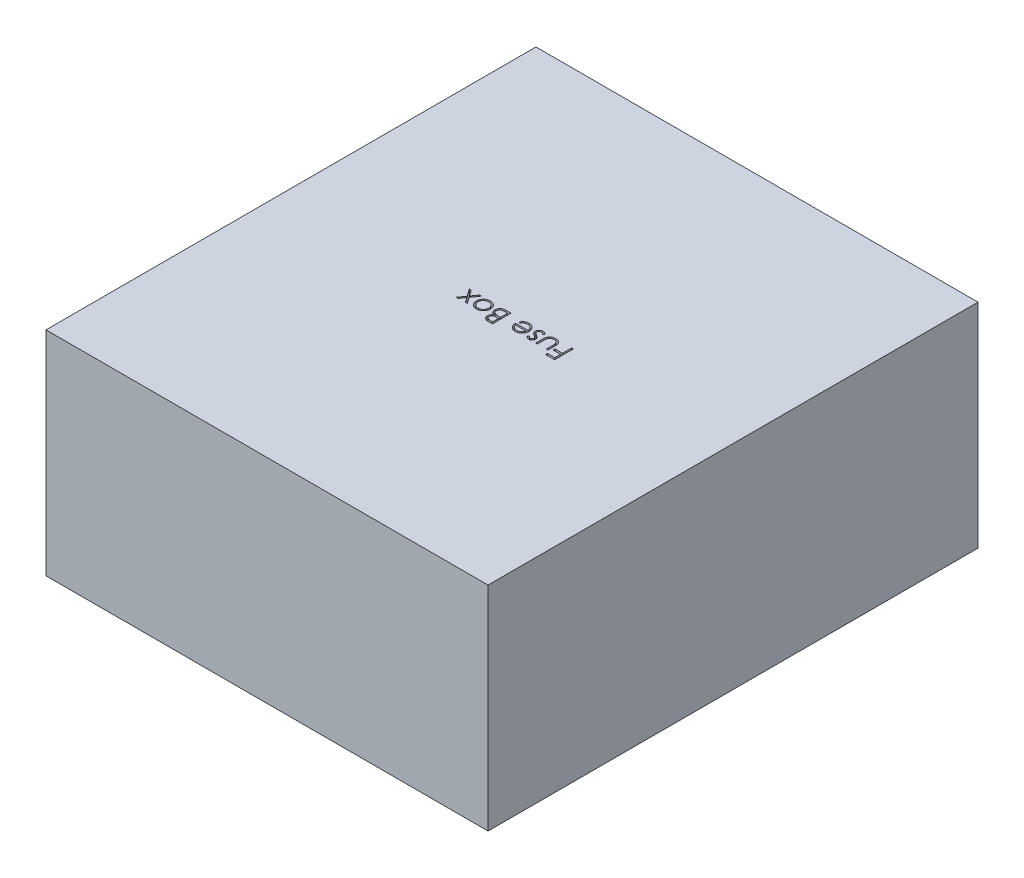
from build123d import *

# Parameters (mm, degrees)
SKETCH1_W           = 83
SKETCH1_H           = 92
BOSS_EXTRUDE1_DEPTH = 40
CUT_EXTRUDE1_DEPTH  = 2


with BuildPart() as part:
    # Sketch1 → Boss-Extrude1 (new body)
    with BuildSketch(Plane(origin=(0, 0, 0), x_dir=(1, 0, 0), z_dir=(0, 1, 0))):
        Rectangle(SKETCH1_W, SKETCH1_H)
    extrude(amount=BOSS_EXTRUDE1_DEPTH)

    # Sketch2 → Cut-Extrude1 (cut)
    # profile 1 of 7: a face of its own
    with BuildSketch(Plane(origin=(0, 40, 0), x_dir=(-1, 0, 0), z_dir=(0, 1, 0))):
        Polygon((-11.110345403, 3.114697888), (-9.405217198, 3.114697888), (-9.405217198, 2.755723529), (-10.796242839, 2.755723529), (-10.796242839, 1.678800452), (-9.405217198, 1.678800452), (-9.405217198, 1.319826093), (-10.796242839, 1.319826093), (-10.796242839, -0.385302112), (-11.110345403, -0.385302112), align=None)
    # profile 2 of 7: a face of its own
    with BuildSketch(Plane(origin=(0, 40, 0), x_dir=(-1, 0, 0), z_dir=(0, 1, 0))):
        with BuildLine():
            Line((-8.911627455, 2.172390196), (-8.59752489, 2.172390196))
            Line((-8.59752489, 2.172390196), (-8.59752489, 0.986092119))
            add(Edge.make_bspline(
                [(-8.59752489, 0.986092119), (-8.597382986, 0.95126937), (-8.597111528, 0.884655082), (-8.595270587, 0.788799895), (-8.590940494, 0.701383182), (-8.585526669, 0.622354446), (-8.578564533, 0.551727054), (-8.570281172, 0.489747697), (-8.561022751, 0.435713513), (-8.551960037, 0.403170157), (-8.547745243, 0.388035228)],
                knots=[0, 0, 0, 0, 1.388932606, 2.656963016, 3.823490214, 4.879454478, 5.816252168, 6.653371382, 7.373723809, 8, 8, 8, 8], degree=3))
            add(Edge.make_bspline(
                [(-8.547745243, 0.388035228), (-8.540983788, 0.369012357), (-8.527601447, 0.331362096), (-8.503327963, 0.276973091), (-8.473299627, 0.226597808), (-8.440439799, 0.178293736), (-8.402540391, 0.133491749), (-8.36008092, 0.092267505), (-8.314482683, 0.053063414), (-8.24672766, 0.006678622), (-8.154068394, -0.043036708), (-8.032415638, -0.085932527), (-7.900511413, -0.111568347), (-7.809346693, -0.114542602), (-7.762488833, -0.116071343)],
                knots=[0, 0, 0, 0, 0.725840625, 1.436591201, 2.137033971, 2.831655856, 3.53531722, 4.242432219, 4.957935707, 5.694543706, 7.190802206, 8.724350549, 10.316345118, 12, 12, 12, 12], degree=3))
            add(Edge.make_bspline(
                [(-7.762488833, -0.116071343), (-7.715635325, -0.114510094), (-7.624982457, -0.111489367), (-7.494527488, -0.086705828), (-7.375276073, -0.045300139), (-7.268425122, 0.012507273), (-7.174459282, 0.083249335), (-7.096154863, 0.166258144), (-7.031547608, 0.258907531), (-7.003338188, 0.32803181), (-6.989151493, 0.362794843)],
                knots=[0, 0, 0, 0, 1.157059328, 2.238695713, 3.266970494, 4.264342957, 5.228770407, 6.160125903, 7.074715775, 8, 8, 8, 8], degree=3))
            add(Edge.make_bspline(
                [(-6.989151493, 0.362794843), (-6.984957263, 0.376761142), (-6.975684845, 0.407637217), (-6.965722493, 0.460016966), (-6.956748032, 0.52248157), (-6.949084855, 0.595439779), (-6.943619693, 0.678700932), (-6.940673666, 0.772239008), (-6.937345391, 0.875760368), (-6.937294875, 0.948228127), (-6.93726848, 0.986092119)],
                knots=[0, 0, 0, 0, 0.557542046, 1.232589297, 2.036731608, 2.971723315, 4.038036528, 5.22795436, 6.551621927, 8, 8, 8, 8], degree=3))
            Line((-6.93726848, 0.986092119), (-6.93726848, 2.172390196))
            Line((-6.93726848, 2.172390196), (-6.623165916, 2.172390196))
            Line((-6.623165916, 2.172390196), (-6.623165916, 0.927197888))
            add(Edge.make_bspline(
                [(-6.623165916, 0.927197888), (-6.623607611, 0.884890717), (-6.624464559, 0.802809017), (-6.629971903, 0.683524905), (-6.639421515, 0.572362661), (-6.6537642, 0.469263441), (-6.670629875, 0.374305959), (-6.692386148, 0.287368513), (-6.718364386, 0.208718959), (-6.747669901, 0.136977182), (-6.782291768, 0.071930288), (-6.819118789, 0.010194471), (-6.861643561, -0.046698464), (-6.906413795, -0.101580601), (-6.956215451, -0.151722128), (-7.01011531, -0.198273604), (-7.06735473, -0.241946636), (-7.129203928, -0.281037915), (-7.19475999, -0.316254561), (-7.264103847, -0.347470639), (-7.338084846, -0.372173216), (-7.415748483, -0.393483882), (-7.497475262, -0.410198351), (-7.583186395, -0.421984918), (-7.672853011, -0.429210249), (-7.733962471, -0.429847293), (-7.76529332, -0.430173907)],
                knots=[0, 0, 0, 0, 1.493040784, 2.896703357, 4.213163133, 5.428574705, 6.569057535, 7.615249723, 8.588095153, 9.490268104, 10.346124644, 11.18633936, 12.024365274, 12.850166724, 13.684164916, 14.514361689, 15.362232829, 16.222528818, 17.093394965, 17.986930858, 18.902426812, 19.842810585, 20.827885679, 21.843828298, 22.894529745, 24, 24, 24, 24], degree=3))
            add(Edge.make_bspline(
                [(-7.76529332, -0.430173907), (-7.796389834, -0.429834199), (-7.857497379, -0.429166643), (-7.947168623, -0.422024836), (-8.03311723, -0.410216665), (-8.115037628, -0.393361448), (-8.193012026, -0.372322378), (-8.267356265, -0.347318842), (-8.337199828, -0.31623836), (-8.403381832, -0.281260803), (-8.465384221, -0.241695528), (-8.523492799, -0.198327488), (-8.577629651, -0.151221425), (-8.627806719, -0.100574068), (-8.673319696, -0.045757131), (-8.714735738, 0.012788429), (-8.752692443, 0.074482518), (-8.787045233, 0.14054568), (-8.816556989, 0.21311769), (-8.842612234, 0.293414787), (-8.863922873, 0.382317304), (-8.881265341, 0.479749232), (-8.895216782, 0.585244274), (-8.904902924, 0.699412689), (-8.910318755, 0.821976381), (-8.911181816, 0.906626271), (-8.911627455, 0.950334907)],
                knots=[0, 0, 0, 0, 1.083640291, 2.129454052, 3.13281866, 4.105697902, 5.042300162, 5.946461698, 6.836384745, 7.703652036, 8.553297018, 9.397182691, 10.228592656, 11.052265423, 11.879314572, 12.708807002, 13.549817954, 14.402308542, 15.300838682, 16.27712199, 17.341985831, 18.484375296, 19.725102775, 21.0496083, 22.476576903, 24, 24, 24, 24], degree=3))
            Line((-8.911627455, 0.950334907), (-8.911627455, 2.172390196))
        make_face()
    # profile 3 of 7: a face of its own
    with BuildSketch(Plane(origin=(0, 40, 0), x_dir=(-1, 0, 0), z_dir=(0, 1, 0))):
        with BuildLine():
            Line((-4.693678737, 1.853379779), (-4.906819762, 1.633928657))
            add(Edge.make_bspline(
                [(-4.906819762, 1.633928657), (-4.925210266, 1.655241804), (-4.960664992, 1.696331041), (-5.016896473, 1.751268107), (-5.072920076, 1.797405046), (-5.12796889, 1.836357305), (-5.183427159, 1.865806452), (-5.238644077, 1.887301314), (-5.293676815, 1.900603119), (-5.330462851, 1.902317558), (-5.348526493, 1.903159427)],
                knots=[0, 0, 0, 0, 1.26578478, 2.440284043, 3.530471711, 4.527705817, 5.468200915, 6.346673037, 7.188140097, 8, 8, 8, 8], degree=3))
            add(Edge.make_bspline(
                [(-5.348526493, 1.903159427), (-5.370665883, 1.902084554), (-5.414233069, 1.899969356), (-5.476658887, 1.878855926), (-5.534609512, 1.846447187), (-5.584766492, 1.800478604), (-5.627254172, 1.747714335), (-5.658267853, 1.68871801), (-5.677233837, 1.625269966), (-5.679638569, 1.581240108), (-5.680858224, 1.558908625)],
                knots=[0, 0, 0, 0, 0.99966794, 1.967205029, 2.953328237, 3.988086729, 5.028030931, 6.008226631, 6.989793394, 8, 8, 8, 8], degree=3))
            add(Edge.make_bspline(
                [(-5.680858224, 1.558908625), (-5.679747412, 1.538696581), (-5.677528918, 1.49832947), (-5.660282239, 1.438781437), (-5.632816167, 1.380724398), (-5.607145973, 1.345161492), (-5.593919121, 1.326837311)],
                knots=[0, 0, 0, 0, 0.960159726, 1.917612774, 2.927026955, 4, 4, 4, 4], degree=3))
            add(Edge.make_bspline(
                [(-5.593919121, 1.326837311), (-5.585955627, 1.317052727), (-5.569006335, 1.296227472), (-5.53719782, 1.267323619), (-5.501175317, 1.235381368), (-5.457855379, 1.203444531), (-5.409104351, 1.169812806), (-5.353865067, 1.135810673), (-5.293890562, 1.098846248), (-5.250953255, 1.075401812), (-5.228634666, 1.063215516)],
                knots=[0, 0, 0, 0, 0.66740084, 1.420478572, 2.27185888, 3.217733974, 4.268547843, 5.408967954, 6.65319498, 8, 8, 8, 8], degree=3))
            add(Edge.make_bspline(
                [(-5.228634666, 1.063215516), (-5.201421089, 1.047970614), (-5.148853419, 1.018522481), (-5.074160652, 0.972812778), (-5.006373611, 0.927381353), (-4.944917943, 0.88271408), (-4.890976134, 0.837561212), (-4.842911582, 0.793653455), (-4.801923138, 0.749664147), (-4.778969211, 0.718931033), (-4.767997647, 0.704241157)],
                knots=[0, 0, 0, 0, 1.27191281, 2.456916733, 3.569705269, 4.599008579, 5.553216877, 6.436649441, 7.252746552, 8, 8, 8, 8], degree=3))
            add(Edge.make_bspline(
                [(-4.767997647, 0.704241157), (-4.749787119, 0.674575069), (-4.71354479, 0.615534048), (-4.675486524, 0.518315621), (-4.653426249, 0.415205118), (-4.650364029, 0.344672898), (-4.648806942, 0.308808465)],
                knots=[0, 0, 0, 0, 0.995354457, 1.980940102, 2.973342416, 4, 4, 4, 4], degree=3))
            add(Edge.make_bspline(
                [(-4.648806942, 0.308808465), (-4.649526476, 0.283539319), (-4.650944396, 0.233743706), (-4.660802463, 0.160408876), (-4.677757439, 0.090274319), (-4.700851193, 0.022579034), (-4.732035566, -0.041379906), (-4.768583363, -0.103216155), (-4.812458275, -0.161592086), (-4.86254965, -0.216431046), (-4.917395144, -0.266516793), (-4.975901283, -0.310540747), (-5.038140113, -0.347115084), (-5.103666915, -0.377380429), (-5.172630569, -0.401448687), (-5.245041858, -0.418111219), (-5.320670612, -0.42808398), (-5.372100421, -0.429468456), (-5.39830614, -0.430173907)],
                knots=[0, 0, 0, 0, 1.032770009, 2.035186124, 3.017557409, 3.978232242, 4.952395191, 5.920591857, 6.910227898, 7.931268572, 8.952309245, 9.941945286, 10.918353717, 11.897095711, 12.887975737, 13.898235213, 14.929059601, 16, 16, 16, 16], degree=3))
            add(Edge.make_bspline(
                [(-5.39830614, -0.430173907), (-5.433673316, -0.429181206), (-5.503916243, -0.427209599), (-5.607805962, -0.408703538), (-5.709326721, -0.379908144), (-5.807710261, -0.34019221), (-5.900756375, -0.290041497), (-5.985887299, -0.229979103), (-6.063398762, -0.161989106), (-6.107517036, -0.109876195), (-6.129576173, -0.08381974)],
                knots=[0, 0, 0, 0, 1.013940152, 2.01379169, 3.017749504, 4.037548394, 5.051665909, 6.043208538, 7.021604269, 8, 8, 8, 8], degree=3))
            Line((-6.129576173, -0.08381974), (-5.921342999, 0.153159427))
            add(Edge.make_bspline(
                [(-5.921342999, 0.153159427), (-5.901570586, 0.131804662), (-5.863238774, 0.090405222), (-5.801937557, 0.035280882), (-5.739558156, -0.01092039), (-5.67672347, -0.049563804), (-5.612503375, -0.079339208), (-5.547257761, -0.100257801), (-5.481119337, -0.113701994), (-5.436697201, -0.115280276), (-5.414431942, -0.116071343)],
                knots=[0, 0, 0, 0, 1.179806542, 2.287233372, 3.337373186, 4.324005949, 5.273901747, 6.200048787, 7.097828587, 8, 8, 8, 8], degree=3))
            add(Edge.make_bspline(
                [(-5.414431942, -0.116071343), (-5.384114016, -0.114700518), (-5.324877874, -0.112022156), (-5.240034116, -0.087705064), (-5.161695489, -0.049575112), (-5.093672144, 0.004509586), (-5.035769983, 0.067465159), (-4.993841808, 0.138379278), (-4.967565633, 0.215170735), (-4.964479634, 0.268403037), (-4.962909506, 0.295487151)],
                knots=[0, 0, 0, 0, 1.072336372, 2.095165389, 3.102688358, 4.141489647, 5.156069229, 6.117746104, 7.042326257, 8, 8, 8, 8], degree=3))
            add(Edge.make_bspline(
                [(-4.962909506, 0.295487151), (-4.9639958, 0.31779677), (-4.966140543, 0.361844125), (-4.982983815, 0.425594466), (-5.009596667, 0.486063747), (-5.035801316, 0.521453394), (-5.049147487, 0.539477536)],
                knots=[0, 0, 0, 0, 1.013901739, 2.00181326, 2.98231254, 4, 4, 4, 4], degree=3))
            add(Edge.make_bspline(
                [(-5.049147487, 0.539477536), (-5.057169881, 0.548512898), (-5.074645554, 0.56819518), (-5.106700795, 0.596620259), (-5.145082657, 0.627258358), (-5.19022282, 0.659589947), (-5.242212282, 0.693188552), (-5.301261757, 0.727877904), (-5.36656231, 0.76530563), (-5.412732941, 0.790125285), (-5.436867839, 0.803099331)],
                knots=[0, 0, 0, 0, 0.615000592, 1.339693406, 2.178160186, 3.116406724, 4.166410947, 5.330106347, 6.604359322, 8, 8, 8, 8], degree=3))
            add(Edge.make_bspline(
                [(-5.436867839, 0.803099331), (-5.462914479, 0.817638462), (-5.513427227, 0.845834479), (-5.584974518, 0.889750559), (-5.649521872, 0.934417833), (-5.708622446, 0.977330673), (-5.760783452, 1.020751617), (-5.8057994, 1.064728868), (-5.845442616, 1.107488854), (-5.867390028, 1.137786151), (-5.877873448, 1.152257984)],
                knots=[0, 0, 0, 0, 1.262093308, 2.447601706, 3.550203992, 4.582594899, 5.537233252, 6.418365656, 7.244515135, 8, 8, 8, 8], degree=3))
            add(Edge.make_bspline(
                [(-5.877873448, 1.152257984), (-5.896004048, 1.181403599), (-5.932271583, 1.239705015), (-5.967486774, 1.337015491), (-5.991692803, 1.439460549), (-5.993855193, 1.510147403), (-5.994960788, 1.546288433)],
                knots=[0, 0, 0, 0, 0.985009483, 1.970363186, 2.962279964, 4, 4, 4, 4], degree=3))
            add(Edge.make_bspline(
                [(-5.994960788, 1.546288433), (-5.994426593, 1.569913831), (-5.993381097, 1.616152082), (-5.985037045, 1.684090902), (-5.969845334, 1.748639056), (-5.950790411, 1.810765919), (-5.924307407, 1.869268013), (-5.892661502, 1.924925484), (-5.855474077, 1.977661402), (-5.812630786, 2.026664534), (-5.765524141, 2.071173861), (-5.714629371, 2.109972489), (-5.661091114, 2.143078843), (-5.604682695, 2.170844004), (-5.544862222, 2.191845387), (-5.482047836, 2.206302772), (-5.416366681, 2.215957975), (-5.371465555, 2.216821059), (-5.348526493, 2.217261991)],
                knots=[0, 0, 0, 0, 1.087655834, 2.128696564, 3.144119009, 4.137814668, 5.115653402, 6.093965665, 7.082169637, 8.081268856, 9.086088321, 10.061021666, 11.022561449, 11.980240094, 12.950172527, 13.934149372, 14.944599409, 16, 16, 16, 16], degree=3))
            add(Edge.make_bspline(
                [(-5.348526493, 2.217261991), (-5.32133443, 2.21615765), (-5.266440208, 2.213928252), (-5.184085582, 2.196222562), (-5.10185224, 2.167089458), (-5.01952889, 2.126853224), (-4.9377186, 2.074786349), (-4.855701744, 2.011857049), (-4.772493713, 1.938479335), (-4.7205374, 1.882380109), (-4.693678737, 1.853379779)],
                knots=[0, 0, 0, 0, 0.845714091, 1.707292901, 2.609013841, 3.555613372, 4.552488639, 5.621697636, 6.770543573, 8, 8, 8, 8], degree=3))
        make_face()
    # profile 4 of 7: a face of its own
    with BuildSketch(Plane(origin=(0, 40, 0), x_dir=(-1, 0, 0), z_dir=(0, 1, 0))):
        with BuildLine():
            Line((-1.92144316, 0.422390196), (-1.642396685, 0.275855741))
            add(Edge.make_bspline(
                [(-1.642396685, 0.275855741), (-1.664633281, 0.23641241), (-1.707896889, 0.159671307), (-1.782297637, 0.054239446), (-1.86028971, -0.04060827), (-1.945393678, -0.122337924), (-2.035063357, -0.193589309), (-2.129796011, -0.255927134), (-2.230084829, -0.309045654), (-2.335934554, -0.353798182), (-2.448234105, -0.388207676), (-2.567255621, -0.412511897), (-2.693227117, -0.427535165), (-2.779573297, -0.429280306), (-2.82378691, -0.430173907)],
                knots=[0, 0, 0, 0, 1.120438281, 2.179929193, 3.190490725, 4.156257408, 5.095198341, 6.022838206, 6.959905092, 7.901321166, 8.864066838, 9.862729781, 10.905609505, 12, 12, 12, 12], degree=3))
            add(Edge.make_bspline(
                [(-2.82378691, -0.430173907), (-2.872928887, -0.429026731), (-2.968790649, -0.426788925), (-3.108330396, -0.40749646), (-3.239709814, -0.376024101), (-3.362921518, -0.33205856), (-3.47766377, -0.274631236), (-3.584164625, -0.204671754), (-3.682984151, -0.122539499), (-3.77100836, -0.027523056), (-3.850252243, 0.074158901), (-3.920178063, 0.180114786), (-3.978635494, 0.29007801), (-4.026188104, 0.403348534), (-4.064592969, 0.519212428), (-4.091359673, 0.638723896), (-4.106789421, 0.76155948), (-4.109153866, 0.844656816), (-4.110345403, 0.886532824)],
                knots=[0, 0, 0, 0, 1.145258523, 2.234067595, 3.276747158, 4.290159414, 5.277019952, 6.260822364, 7.254936242, 8.264827045, 9.274100331, 10.257902744, 11.220704747, 12.172965371, 13.118907548, 14.062713208, 15.023725156, 16, 16, 16, 16], degree=3))
            add(Edge.make_bspline(
                [(-4.110345403, 0.886532824), (-4.109286262, 0.925827655), (-4.107187184, 1.003704819), (-4.093956396, 1.118970364), (-4.070508103, 1.230998816), (-4.038331779, 1.339883264), (-3.996780533, 1.445441398), (-3.945948314, 1.547737462), (-3.885755936, 1.646662602), (-3.839283262, 1.709065735), (-3.815874249, 1.74049917)],
                knots=[0, 0, 0, 0, 1.024358464, 2.0301432, 3.019427413, 4.004406732, 4.986367066, 5.972626655, 6.978780325, 8, 8, 8, 8], degree=3))
            add(Edge.make_bspline(
                [(-3.815874249, 1.74049917), (-3.784166567, 1.77836804), (-3.72175562, 1.852906191), (-3.616199265, 1.950844517), (-3.501899068, 2.032888292), (-3.380287442, 2.100895428), (-3.249950968, 2.152569075), (-3.112641677, 2.191076657), (-2.966796091, 2.212654668), (-2.86709087, 2.215702502), (-2.81607457, 2.217261991)],
                knots=[0, 0, 0, 0, 1.030682036, 2.02871468, 2.997146059, 3.962720338, 4.930598197, 5.918074684, 6.934738563, 8, 8, 8, 8], degree=3))
            add(Edge.make_bspline(
                [(-2.81607457, 2.217261991), (-2.763626965, 2.215907942), (-2.660736719, 2.213251607), (-2.510704598, 2.188625273), (-2.368743881, 2.149572719), (-2.234911377, 2.094418928), (-2.109193516, 2.023259376), (-1.992407467, 1.935117535), (-1.882555954, 1.832699448), (-1.818647375, 1.753936238), (-1.786126653, 1.713856542)],
                knots=[0, 0, 0, 0, 1.056321875, 2.072262726, 3.055038591, 4.01806755, 4.982017516, 5.957941055, 6.960871419, 8, 8, 8, 8], degree=3))
            add(Edge.make_bspline(
                [(-1.786126653, 1.713856542), (-1.763999715, 1.683652961), (-1.719893122, 1.623446842), (-1.664646022, 1.525275685), (-1.616688627, 1.422565091), (-1.578355666, 1.313654793), (-1.547316165, 1.199835213), (-1.524859346, 1.080292669), (-1.511689727, 0.955062757), (-1.50910103, 0.869736202), (-1.507781301, 0.82623635)],
                knots=[0, 0, 0, 0, 0.94817472, 1.890038105, 2.849395472, 3.817997239, 4.812318967, 5.836947057, 6.897266129, 8, 8, 8, 8], degree=3))
            Line((-1.507781301, 0.82623635), (-3.796242839, 0.82623635))
            add(Edge.make_bspline(
                [(-3.796242839, 0.82623635), (-3.794703233, 0.792535886), (-3.791675659, 0.726265282), (-3.777560516, 0.629294499), (-3.755311742, 0.536921157), (-3.724042679, 0.449838115), (-3.686175834, 0.366907987), (-3.639790117, 0.28874595), (-3.584450563, 0.21570802), (-3.522724864, 0.147140882), (-3.454017769, 0.086080121), (-3.381735021, 0.031428345), (-3.304841456, -0.014377252), (-3.223943373, -0.051557141), (-3.139171588, -0.080663457), (-3.050499393, -0.100531278), (-2.958101276, -0.113838385), (-2.895115542, -0.11531805), (-2.86304973, -0.116071343)],
                knots=[0, 0, 0, 0, 1.094153842, 2.151609401, 3.174256925, 4.172055639, 5.149267565, 6.128595816, 7.11444997, 8.118368179, 9.117203808, 10.09244225, 11.054858984, 12.015122123, 12.976791628, 13.957293641, 14.960065497, 16, 16, 16, 16], degree=3))
            add(Edge.make_bspline(
                [(-2.86304973, -0.116071343), (-2.831698583, -0.115463286), (-2.769491892, -0.114256785), (-2.676851034, -0.102524874), (-2.585711507, -0.083554598), (-2.496450524, -0.057664608), (-2.410879678, -0.026087756), (-2.331634128, 0.012015102), (-2.258753912, 0.054164848), (-2.190636946, 0.102374523), (-2.124565952, 0.16138271), (-2.059023466, 0.235018431), (-1.988746812, 0.322105959), (-1.94475722, 0.387651625), (-1.92144316, 0.422390196)],
                knots=[0, 0, 0, 0, 0.99110716, 1.966546729, 2.947904876, 3.932708344, 4.903319531, 5.828989031, 6.710028674, 7.56322171, 8.463672341, 9.504779593, 10.677557249, 12, 12, 12, 12], degree=3))
        make_face()
        with BuildLine():
            add(Edge.make_bspline(
                [(-1.821883865, 1.140338914), (-1.833380489, 1.182001788), (-1.855507791, 1.262189408), (-1.901744155, 1.373230299), (-1.953815696, 1.4719182), (-2.015437427, 1.557497833), (-2.085256153, 1.633501346), (-2.165901336, 1.699919931), (-2.256337229, 1.759337382), (-2.35609637, 1.809489881), (-2.461738155, 1.85217974), (-2.572344347, 1.880804856), (-2.685202135, 1.900414398), (-2.761536421, 1.902240507), (-2.799948769, 1.903159427)],
                knots=[0, 0, 0, 0, 1.154881502, 2.222775134, 3.210006277, 4.132804581, 5.035138423, 5.962687519, 6.919655026, 7.923214229, 8.944639381, 9.960483929, 10.97369054, 12, 12, 12, 12], degree=3))
            add(Edge.make_bspline(
                [(-2.799948769, 1.903159427), (-2.831298207, 1.902547755), (-2.893269456, 1.901338609), (-2.984570524, 1.88986848), (-3.072250223, 1.870908635), (-3.156955511, 1.844943678), (-3.237576379, 1.810335076), (-3.315771148, 1.769751849), (-3.389551544, 1.720210265), (-3.435692839, 1.682451411), (-3.459003256, 1.663375773)],
                knots=[0, 0, 0, 0, 1.04873581, 2.073130211, 3.073294108, 4.04793562, 5.032784715, 6.005352987, 6.992311501, 8, 8, 8, 8], degree=3))
            add(Edge.make_bspline(
                [(-3.459003256, 1.663375773), (-3.475696538, 1.648281457), (-3.509479672, 1.617734241), (-3.554620194, 1.565105035), (-3.597840666, 1.508353472), (-3.637174319, 1.445308348), (-3.673251905, 1.376687569), (-3.707011883, 1.303069934), (-3.737398295, 1.223896803), (-3.754494405, 1.168724364), (-3.763290115, 1.140338914)],
                knots=[0, 0, 0, 0, 0.879870761, 1.780643979, 2.707998968, 3.669668524, 4.684282772, 5.740141944, 6.837334558, 8, 8, 8, 8], degree=3))
            Line((-3.763290115, 1.140338914), (-1.821883865, 1.140338914))
        make_face(mode=Mode.SUBTRACT)
    # profile 5 of 7: a face of its own
    with BuildSketch(Plane(origin=(0, 40, 0), x_dir=(-1, 0, 0), z_dir=(0, 1, 0))):
        with BuildLine():
            Line((0.556321263, 3.114697888), (1.239213892, 3.114697888))
            add(Edge.make_bspline(
                [(1.239213892, 3.114697888), (1.27264237, 3.114522138), (1.33743508, 3.11418149), (1.431654522, 3.108898359), (1.519903333, 3.101694689), (1.602207105, 3.090264596), (1.678527807, 3.076472819), (1.749095445, 3.059771003), (1.813685617, 3.039744389), (1.890798353, 3.007898108), (1.978719014, 2.96057494), (2.073917407, 2.890646375), (2.155321646, 2.805113911), (2.225507963, 2.708631256), (2.281309083, 2.602495484), (2.32167838, 2.489236295), (2.347236256, 2.370314554), (2.34986469, 2.288671376), (2.351193058, 2.247410228)],
                knots=[0, 0, 0, 0, 1.001505555, 1.941167018, 2.826882275, 3.653841531, 4.429895133, 5.150066043, 5.825578002, 6.45369114, 7.647487171, 8.808567382, 9.977351308, 11.170798116, 12.373658725, 13.556498008, 14.765093433, 16, 16, 16, 16], degree=3))
            add(Edge.make_bspline(
                [(2.351193058, 2.247410228), (2.35009984, 2.208757672), (2.347951562, 2.132801755), (2.327408803, 2.021707646), (2.295248135, 1.915956427), (2.250542886, 1.815934042), (2.192440889, 1.723900429), (2.123582571, 1.639113163), (2.040505768, 1.565162106), (1.978262528, 1.523819203), (1.946645783, 1.502818882)],
                knots=[0, 0, 0, 0, 1.044552857, 2.05264487, 3.044412934, 4.028983338, 5.005914585, 5.980388656, 6.974128949, 8, 8, 8, 8], degree=3))
            add(Edge.make_bspline(
                [(1.946645783, 1.502818882), (1.98640621, 1.487553883), (2.062477758, 1.458348159), (2.16716377, 1.406712695), (2.257358615, 1.350550584), (2.333755761, 1.289218734), (2.399093416, 1.223109923), (2.456146357, 1.151254809), (2.504827732, 1.072716051), (2.546540655, 0.988312516), (2.579089411, 0.898906047), (2.603465316, 0.805335271), (2.617432765, 0.707935716), (2.619420406, 0.641650337), (2.620423827, 0.608187472)],
                knots=[0, 0, 0, 0, 1.27268992, 2.434971085, 3.483601985, 4.442670788, 5.356604649, 6.2567628, 7.179492994, 8.113709626, 9.066344395, 10.018646069, 10.999752585, 12, 12, 12, 12], degree=3))
            add(Edge.make_bspline(
                [(2.620423827, 0.608187472), (2.619446981, 0.574020599), (2.61752501, 0.506796321), (2.603345038, 0.408041187), (2.579335931, 0.31366624), (2.546264784, 0.223061058), (2.50310247, 0.136400923), (2.450574505, 0.053587659), (2.387942942, -0.024546672), (2.317880073, -0.098870295), (2.238617927, -0.165698082), (2.153102172, -0.225213789), (2.060255853, -0.274159851), (1.961603859, -0.315275872), (1.856039542, -0.346683071), (1.744036935, -0.368655645), (1.625692633, -0.383460682), (1.544482882, -0.384677887), (1.502835686, -0.385302112)],
                knots=[0, 0, 0, 0, 0.978564426, 1.925352924, 2.850884081, 3.763762016, 4.682927383, 5.618979971, 6.567305752, 7.547517671, 8.540179244, 9.531824382, 10.526200242, 11.540722885, 12.589160233, 13.674978461, 14.80764778, 16, 16, 16, 16], degree=3))
            Line((1.502835686, -0.385302112), (0.556321263, -0.385302112))
            Line((0.556321263, -0.385302112), (0.556321263, 3.114697888))
        make_face()
        with BuildLine():
            Line((0.870423827, 2.755723529), (0.870423827, 1.633928657))
            Line((0.870423827, 1.633928657), (1.081461488, 1.633928657))
            add(Edge.make_bspline(
                [(1.081461488, 1.633928657), (1.112310283, 1.634328581), (1.171916442, 1.635101313), (1.258236339, 1.63731483), (1.338361357, 1.643512874), (1.41215319, 1.649709136), (1.479495634, 1.659783723), (1.540239496, 1.671775846), (1.595338093, 1.684458751), (1.658877638, 1.706028238), (1.730950587, 1.737905914), (1.807783691, 1.78737775), (1.87551816, 1.846302103), (1.932715348, 1.914293065), (1.979526819, 1.98915925), (2.012040534, 2.069706131), (2.034087818, 2.153926263), (2.036079349, 2.211744516), (2.037090494, 2.241100132)],
                knots=[0, 0, 0, 0, 1.156816544, 2.235205308, 3.236616184, 4.169592532, 5.011045266, 5.787822928, 6.49130361, 7.128639758, 8.301311294, 9.436451833, 10.541879658, 11.654887649, 12.756523258, 13.837046038, 14.901820046, 16, 16, 16, 16], degree=3))
            add(Edge.make_bspline(
                [(2.037090494, 2.241100132), (2.036564314, 2.260525903), (2.035532154, 2.298631675), (2.027078851, 2.35418103), (2.012711277, 2.406424782), (1.994256984, 2.456078892), (1.968468295, 2.501590743), (1.938104832, 2.544533938), (1.901419141, 2.583446057), (1.859661829, 2.619815555), (1.811653206, 2.652060083), (1.757421914, 2.680300846), (1.696234237, 2.703041623), (1.629121382, 2.722957775), (1.555050295, 2.736946069), (1.474875741, 2.748599457), (1.387941022, 2.754532199), (1.32779592, 2.755317562), (1.296705879, 2.755723529)],
                knots=[0, 0, 0, 0, 0.91205012, 1.789085906, 2.630437955, 3.453916878, 4.269457761, 5.079663411, 5.91843418, 6.774407191, 7.675494373, 8.627863946, 9.638891023, 10.736472738, 11.911756761, 13.175263542, 14.539845004, 16, 16, 16, 16], degree=3))
            Line((1.296705879, 2.755723529), (0.870423827, 2.755723529))
        make_face(mode=Mode.SUBTRACT)
        with BuildLine():
            Line((0.870423827, 1.274954299), (0.870423827, -0.026327753))
            Line((0.870423827, -0.026327753), (1.317739533, -0.026327753))
            add(Edge.make_bspline(
                [(1.317739533, -0.026327753), (1.349758458, -0.025944005), (1.411470717, -0.025204383), (1.500571947, -0.022789828), (1.583155051, -0.017297553), (1.658843187, -0.008651703), (1.728453639, 0.000726746), (1.791151342, 0.013338027), (1.847444536, 0.027786988), (1.912718844, 0.05012116), (1.986222352, 0.084817631), (2.065433208, 0.137131857), (2.135859426, 0.199455165), (2.195664686, 0.271586079), (2.244677674, 0.350017406), (2.280333129, 0.433162756), (2.302323986, 0.519648284), (2.304986155, 0.578614996), (2.306321263, 0.608187472)],
                knots=[0, 0, 0, 0, 1.160039823, 2.235823828, 3.228722157, 4.157150951, 4.99529583, 5.772374946, 6.472645482, 7.099169577, 8.269452708, 9.405989375, 10.527446681, 11.663510218, 12.788923519, 13.866172445, 14.929861265, 16, 16, 16, 16], degree=3))
            add(Edge.make_bspline(
                [(2.306321263, 0.608187472), (2.306045159, 0.626680812), (2.305497404, 0.663369194), (2.297236789, 0.717285013), (2.285222919, 0.769510886), (2.269691485, 0.820188627), (2.247072018, 0.868402003), (2.220665473, 0.915104563), (2.189704072, 0.960358042), (2.141459906, 1.017570296), (2.071287921, 1.083487309), (1.971581146, 1.148024811), (1.858208848, 1.200072618), (1.775981355, 1.222172094), (1.733504757, 1.233588113)],
                knots=[0, 0, 0, 0, 0.723448775, 1.435228256, 2.130040452, 2.821711965, 3.505591119, 4.210454504, 4.921174351, 5.648778258, 7.137944449, 8.670945889, 10.280296675, 12, 12, 12, 12], degree=3))
            add(Edge.make_bspline(
                [(1.733504757, 1.233588113), (1.716475661, 1.237043197), (1.679553069, 1.244534531), (1.619345488, 1.252442235), (1.550609619, 1.259487295), (1.473186742, 1.264698452), (1.386978901, 1.270084996), (1.291801982, 1.272179817), (1.188044668, 1.274679077), (1.116052295, 1.274860211), (1.078657001, 1.274954299)],
                knots=[0, 0, 0, 0, 0.634451884, 1.375622551, 2.216452059, 3.157844607, 4.20941857, 5.370758133, 6.634282058, 8, 8, 8, 8], degree=3))
            Line((1.078657001, 1.274954299), (0.870423827, 1.274954299))
        make_face(mode=Mode.SUBTRACT)
    # profile 6 of 7: a face of its own
    with BuildSketch(Plane(origin=(0, 40, 0), x_dir=(-1, 0, 0), z_dir=(0, 1, 0))):
        with BuildLine():
            add(Edge.make_bspline(
                [(4.484005558, 2.217261991), (4.531996831, 2.2162401), (4.626095989, 2.214236421), (4.763903875, 2.192821455), (4.89544901, 2.160074091), (5.021235203, 2.114802529), (5.139651498, 2.054120578), (5.252422742, 1.981711287), (5.359239751, 1.895928694), (5.42326278, 1.829570625), (5.455760366, 1.795887792)],
                knots=[0, 0, 0, 0, 1.054011418, 2.066658804, 3.057071809, 4.030435133, 4.997543892, 5.974964718, 6.972108034, 8, 8, 8, 8], degree=3))
            add(Edge.make_bspline(
                [(5.455760366, 1.795887792), (5.48374232, 1.763673806), (5.5391647, 1.699869264), (5.610230419, 1.596413651), (5.671451979, 1.489273551), (5.72051494, 1.377026224), (5.759199964, 1.260651553), (5.78666566, 1.139749542), (5.803002595, 1.014587194), (5.805205562, 0.929583356), (5.806321263, 0.886532824)],
                knots=[0, 0, 0, 0, 1.025258237, 2.030674902, 3.01204498, 3.988269485, 4.97094183, 5.956517959, 6.965070386, 8, 8, 8, 8], degree=3))
            add(Edge.make_bspline(
                [(5.806321263, 0.886532824), (5.805339926, 0.843232766), (5.803400758, 0.757669833), (5.785057141, 0.631650467), (5.756526055, 0.509455645), (5.715694217, 0.391596951), (5.663336108, 0.277714124), (5.59944542, 0.168304574), (5.523573803, 0.063152441), (5.437569807, -0.036849397), (5.34251793, -0.129015612), (5.239401782, -0.209343882), (5.130247748, -0.278165406), (5.013604395, -0.333601822), (4.890536908, -0.377311522), (4.76077984, -0.408011538), (4.62453477, -0.426573222), (4.531507548, -0.428956795), (4.484005558, -0.430173907)],
                knots=[0, 0, 0, 0, 0.998656419, 1.973391657, 2.932242238, 3.890759089, 4.846373663, 5.82037756, 6.809684879, 7.83454468, 8.860553229, 9.859544525, 10.845671541, 11.83227036, 12.833544569, 13.85385346, 14.904124723, 16, 16, 16, 16], degree=3))
            add(Edge.make_bspline(
                [(4.484005558, -0.430173907), (4.436270839, -0.42895271), (4.342779979, -0.426560936), (4.206053997, -0.408083653), (4.076064378, -0.377325671), (3.95283578, -0.333458178), (3.835690933, -0.278163634), (3.725904436, -0.209551945), (3.62270452, -0.128991789), (3.527632536, -0.036855852), (3.44163393, 0.063154104), (3.365760922, 0.168304143), (3.301870596, 0.277714236), (3.249512392, 0.391596921), (3.208680579, 0.509455653), (3.180149486, 0.631650465), (3.161805872, 0.757669834), (3.159866703, 0.843232767), (3.158885366, 0.886532824)],
                knots=[0, 0, 0, 0, 1.099876186, 2.154163076, 3.173186993, 4.173200201, 5.163417411, 6.152872554, 7.150605724, 8.17532212, 9.198891216, 10.186952605, 11.159729845, 12.11414092, 13.071450619, 14.029093627, 15.002601286, 16, 16, 16, 16], degree=3))
            add(Edge.make_bspline(
                [(3.158885366, 0.886532824), (3.160008676, 0.92934937), (3.162232638, 1.014118772), (3.178553147, 1.139045833), (3.205911703, 1.259743222), (3.2446431, 1.375668698), (3.294158291, 1.487424134), (3.354519579, 1.594828965), (3.426310211, 1.697816766), (3.481512163, 1.761538846), (3.509446263, 1.793784427)],
                knots=[0, 0, 0, 0, 1.031353054, 2.041901799, 3.029428768, 4.008703097, 4.981709435, 5.96992636, 6.972712378, 8, 8, 8, 8], degree=3))
            add(Edge.make_bspline(
                [(3.509446263, 1.793784427), (3.541894854, 1.827759366), (3.605710718, 1.894577062), (3.713059446, 1.980109586), (3.825553267, 2.05402566), (3.945278193, 2.113501876), (4.070961051, 2.160340393), (4.203180294, 2.192905908), (4.341455809, 2.214159263), (4.43601543, 2.216217441), (4.484005558, 2.217261991)],
                knots=[0, 0, 0, 0, 1.027980169, 2.021703884, 2.998553061, 3.971491411, 4.943284454, 5.930300938, 6.949603206, 8, 8, 8, 8], degree=3))
        make_face()
        with BuildLine():
            add(Edge.make_bspline(
                [(4.482603315, 1.903159427), (4.448665703, 1.902194835), (4.381666575, 1.900290552), (4.28304699, 1.885806648), (4.188106836, 1.862859144), (4.096665992, 1.830255087), (4.009032819, 1.788156189), (3.925123417, 1.736447828), (3.844690977, 1.675814872), (3.769308914, 1.6063522), (3.700126602, 1.530473206), (3.639648625, 1.449624847), (3.588223519, 1.365118501), (3.54538336, 1.276866289), (3.513476172, 1.183973875), (3.490303149, 1.087493244), (3.475832909, 0.987227828), (3.47394653, 0.919066809), (3.47298793, 0.884429459)],
                knots=[0, 0, 0, 0, 1.021534396, 2.016698045, 2.994645724, 3.958388632, 4.93408049, 5.916473867, 6.921342795, 7.962252576, 8.998418191, 10.008913653, 10.997312074, 11.973003931, 12.956656626, 13.948281152, 14.957379055, 16, 16, 16, 16], degree=3))
            add(Edge.make_bspline(
                [(3.47298793, 0.884429459), (3.474594754, 0.839677432), (3.477783998, 0.750853026), (3.503719235, 0.620041903), (3.547105514, 0.494460051), (3.605692794, 0.374843665), (3.679099013, 0.264171387), (3.765586079, 0.165499903), (3.86422578, 0.080314091), (3.97384228, 0.009633246), (4.092196598, -0.04652651), (4.217452919, -0.086325486), (4.348093613, -0.112197178), (4.437374344, -0.114768652), (4.482603315, -0.116071343)],
                knots=[0, 0, 0, 0, 1.016792936, 2.018143844, 3.017858371, 4.030088057, 5.03801393, 6.028138512, 7.003788237, 7.991172063, 8.984598303, 9.972568034, 10.972917682, 12, 12, 12, 12], degree=3))
            add(Edge.make_bspline(
                [(4.482603315, -0.116071343), (4.527829684, -0.114761062), (4.61710528, -0.112174605), (4.747564456, -0.086455786), (4.872478428, -0.046352125), (4.990709816, 0.009570085), (5.100276419, 0.0805825), (5.199625541, 0.165018877), (5.285374152, 0.264432728), (5.358707757, 0.374990257), (5.418254499, 0.494274609), (5.461437701, 0.620065081), (5.487435287, 0.750847123), (5.490616116, 0.839675454), (5.492218699, 0.884429459)],
                knots=[0, 0, 0, 0, 1.02726834, 2.027799167, 3.010890988, 4.004497153, 4.992059811, 5.971914811, 6.958719428, 7.966827853, 8.981595046, 9.981490638, 10.983022906, 12, 12, 12, 12], degree=3))
            add(Edge.make_bspline(
                [(5.492218699, 0.884429459), (5.491260429, 0.919067016), (5.4893747, 0.987228442), (5.474899736, 1.087490896), (5.451744196, 1.183982492), (5.419772579, 1.276834496), (5.377118565, 1.365347), (5.324701772, 1.449376727), (5.264470746, 1.530753273), (5.194453626, 1.606106914), (5.119150248, 1.67584195), (5.03868521, 1.73647134), (4.954900231, 1.787928935), (4.867521648, 1.830615176), (4.776069081, 1.862562516), (4.681261951, 1.885939148), (4.583063142, 1.900229344), (4.516304098, 1.902176486), (4.482603315, 1.903159427)],
                knots=[0, 0, 0, 0, 1.042956736, 2.052379634, 3.044323526, 4.02829302, 5.004299113, 5.996692471, 7.007513377, 8.048758398, 9.090003419, 10.095195979, 11.07790575, 12.047570684, 13.018257071, 13.989683339, 14.985167495, 16, 16, 16, 16], degree=3))
        make_face(mode=Mode.SUBTRACT)
    # profile 7 of 7: a face of its own
    with BuildSketch(Plane(origin=(0, 40, 0), x_dir=(-1, 0, 0), z_dir=(0, 1, 0))):
        Polygon((6.210167417, 2.172390196), (6.583865334, 2.172390196), (7.242218699, 1.249713914), (7.900572065, 2.172390196), (8.274269981, 2.172390196), (7.429418218, 0.988195484), (8.408885366, -0.385302112), (8.035187449, -0.385302112), (7.242218699, 0.725975933), (6.449249949, -0.385302112), (6.075552033, -0.385302112), (7.055720302, 0.988195484), align=None)
    extrude(amount=-CUT_EXTRUDE1_DEPTH, mode=Mode.SUBTRACT)


solid = part.part
